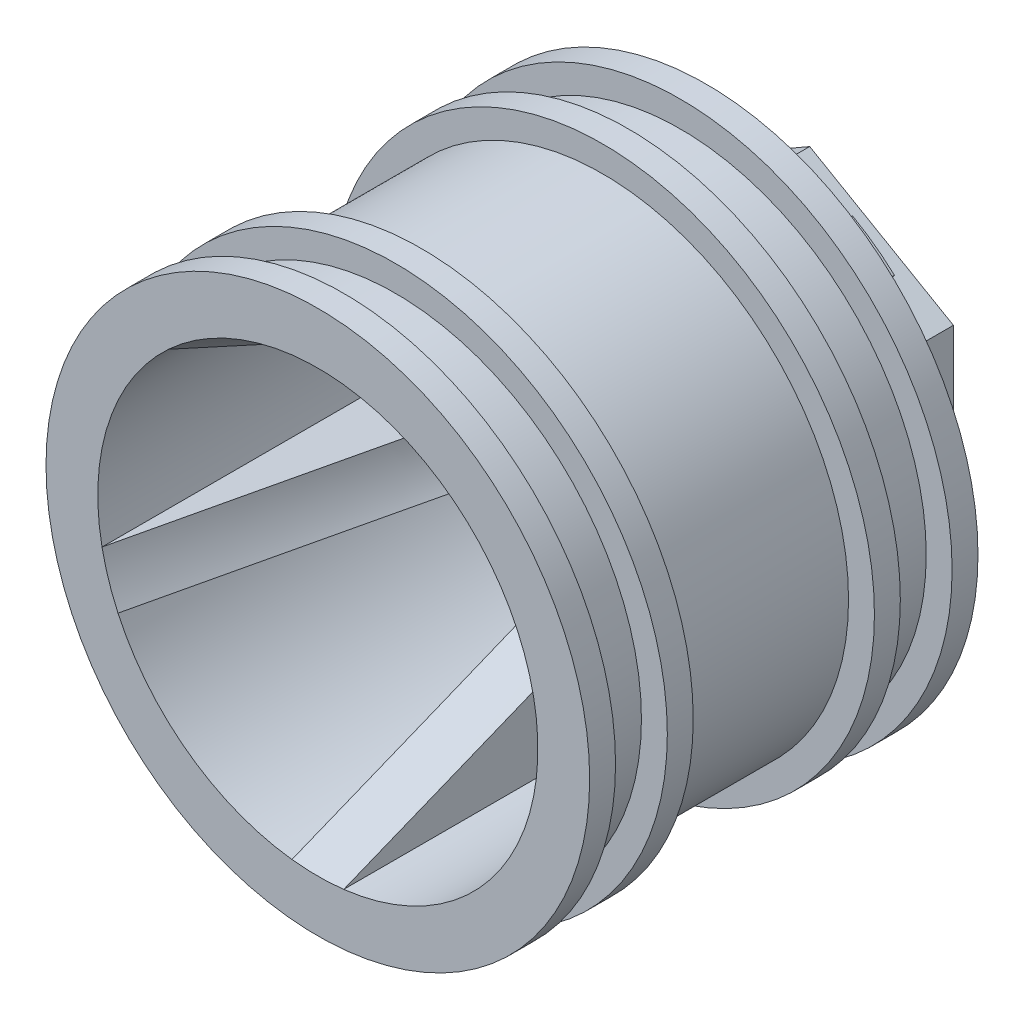
from build123d import *

# Parameters (mm, degrees)
SKETCH_1_R           = 19
SKETCH_1_R_2         = 17
EXTRUDE_1_DEPTH      = 30
SKETCH_16_R          = 17
EXTRUDE_9_DEPTH      = 3
SKETCH_4_R           = 9
EXTRUDE_2_DEPTH      = 10
CUT_EXTRUDE_8_DEPTH  = 10
EXTRUDE_10_DEPTH     = 30
SKETCH_6_R           = 2.25
CUT_EXTRUDE_9_DEPTH  = 70
SKETCH_9_R           = 21
SKETCH_9_R_2         = 19
EXTRUDE_4_DEPTH      = 2
SKETCH_10_R          = 21
SKETCH_10_R_2        = 19
EXTRUDE_5_DEPTH      = 2
EXTRUDE_START        = -2
SKETCH_11_R          = 21
SKETCH_11_R_2        = 19
EXTRUDE_6_DEPTH      = 2
EXTRUDE_START_2      = 2
SKETCH_12_R          = 21
SKETCH_12_R_2        = 19
EXTRUDE_7_DEPTH      = 2
SKETCH_13_W          = 6
SKETCH_13_H          = 6
CUT_EXTRUDE_5_DEPTH  = 2
SKETCH_14_R          = 2.15
EXTRUDE_11_DEPTH     = 5
SKETCH_22_R          = 6.15
CUT_EXTRUDE_10_DEPTH = 4
SKETCH_25_R          = 4.5
CUT_EXTRUDE_11_DEPTH = 2


with BuildPart() as part:
    # 草图1 → 凸台-拉伸1 (new body)
    with BuildSketch(Plane.XY):
        Circle(SKETCH_1_R)
        Circle(SKETCH_1_R_2, mode=Mode.SUBTRACT)
    extrude(amount=EXTRUDE_1_DEPTH)



with BuildPart() as body_2:
    # 草图16 → 凸台-拉伸9 (new body)
    with BuildSketch(Plane(origin=(0, 0, 0), x_dir=(-1, 0, 0), z_dir=(0, 0, -1))):
        with Locations(Location((0, 0, 0), (0, 0, 180))):
            Circle(SKETCH_16_R)
    extrude(amount=EXTRUDE_9_DEPTH)

    # 草图7 → 切除-拉伸8 (cut)
    with BuildSketch(Plane(origin=(0, 0, -3), x_dir=(-1, 0, 0), z_dir=(0, 0, -1))):
        with BuildLine():
            Line((-8.304923146, 14.833349303), (-3.539760668, 8.274665819))
            ThreePointArc((-3.539760668, 8.274665819), (0, 9), (3.539760668, 8.274665819))
            Line((3.539760668, 8.274665819), (8.304923146, 14.833349303))
            ThreePointArc((8.304923146, 14.833349303), (0, 17), (-8.304923146, 14.833349303))
        make_face()
        with BuildLine():
            ThreePointArc((9, 0), (8.990875637, -0.405160803), (8.96352105, -0.809500088))
            Line((8.96352105, -0.809500088), (16.673715902, -3.314694257))
            ThreePointArc((16.673715902, -3.314694257), (16.91823233, -1.665357269), (17, 0))
            ThreePointArc((17, 0), (15.575571404, 6.811870187), (11.540991124, 12.482208294))
            Line((11.540991124, 12.482208294), (6.775828645, 5.92352481))
            ThreePointArc((6.775828645, 5.92352481), (8.425629288, 3.163664188), (9, 0))
        make_face()
        with BuildLine():
            ThreePointArc((7.727453072, -4.613726153), (5.290067271, -7.281152949), (2, -8.774964387))
            Line((2, -8.774964387), (2, -16.881943016))
            ThreePointArc((2, -16.881943016), (9.992349289, -13.753288904), (15.437647924, -7.118920323))
            Line((15.437647924, -7.118920323), (7.727453072, -4.613726153))
        make_face()
        with BuildLine():
            Line((-2, -16.881943016), (-2, -8.774964387))
            ThreePointArc((-2, -8.774964387), (-5.290067271, -7.281152949), (-7.727453072, -4.613726153))
            Line((-7.727453072, -4.613726153), (-15.437647924, -7.118920323))
            ThreePointArc((-15.437647924, -7.118920323), (-9.992349289, -13.753288904), (-2, -16.881943016))
        make_face()
        with BuildLine():
            Line((-16.673715902, -3.314694257), (-8.96352105, -0.809500088))
            ThreePointArc((-8.96352105, -0.809500088), (-8.559508647, 2.781152949), (-6.775828645, 5.92352481))
            Line((-6.775828645, 5.92352481), (-11.540991124, 12.482208294))
            ThreePointArc((-11.540991124, 12.482208294), (-16.167960777, 5.253288904), (-16.673715902, -3.314694257))
        make_face()
    extrude(amount=-CUT_EXTRUDE_8_DEPTH, mode=Mode.SUBTRACT)


with BuildPart() as body_3:
    # 草图4 → 凸台-拉伸2 (new body)
    with BuildSketch(Plane.XY):
        Circle(SKETCH_4_R)
    extrude(amount=EXTRUDE_2_DEPTH)


with BuildPart() as part_1:
    add(part.part)

    add(body_2.part)  # 凸台-拉伸10 merges body 2

    add(body_3.part)  # 凸台-拉伸10 merges body 3
    # 草图21 → 凸台-拉伸10 (add)
    with BuildSketch(Plane.XY):
        with BuildLine():
            ThreePointArc((-6.775828645, 5.92352481), (-5.290067271, 7.281152949), (-3.539760668, 8.274665819))
            Line((-3.539760668, 8.274665819), (-8.304923146, 14.833349303))
            ThreePointArc((-8.304923146, 14.833349303), (-9.992349289, 13.753288904), (-11.540991124, 12.482208294))
            Line((-11.540991124, 12.482208294), (-6.775828645, 5.92352481))
        make_face()
        with BuildLine():
            Line((8.304923146, 14.833349303), (3.539760668, 8.274665819))
            ThreePointArc((3.539760668, 8.274665819), (5.290067271, 7.281152949), (6.775828645, 5.92352481))
            Line((6.775828645, 5.92352481), (11.540991124, 12.482208294))
            ThreePointArc((11.540991124, 12.482208294), (9.992349289, 13.753288904), (8.304923146, 14.833349303))
        make_face()
        with BuildLine():
            Line((16.673715902, -3.314694257), (8.96352105, -0.809500088))
            ThreePointArc((8.96352105, -0.809500088), (8.559508647, -2.781152949), (7.727453072, -4.613726153))
            Line((7.727453072, -4.613726153), (15.437647924, -7.118920323))
            ThreePointArc((15.437647924, -7.118920323), (16.167960777, -5.253288904), (16.673715902, -3.314694257))
        make_face()
        with BuildLine():
            Line((2, -16.881943016), (2, -8.774964387))
            ThreePointArc((2, -8.774964387), (0, -9), (-2, -8.774964387))
            Line((-2, -8.774964387), (-2, -16.881943016))
            ThreePointArc((-2, -16.881943016), (0, -17), (2, -16.881943016))
        make_face()
        with BuildLine():
            ThreePointArc((-7.727453072, -4.613726153), (-8.559508647, -2.781152949), (-8.96352105, -0.809500088))
            Line((-8.96352105, -0.809500088), (-16.673715902, -3.314694257))
            ThreePointArc((-16.673715902, -3.314694257), (-16.167960777, -5.253288904), (-15.437647924, -7.118920323))
            Line((-15.437647924, -7.118920323), (-7.727453072, -4.613726153))
        make_face()
    extrude(amount=EXTRUDE_10_DEPTH)

    # 草图6 → 切除-拉伸9 (cut)
    with BuildSketch(Plane.XY.offset(-3)):
        Circle(SKETCH_6_R)
    extrude(amount=CUT_EXTRUDE_9_DEPTH, mode=Mode.SUBTRACT)

    # 草图9 → 凸台-拉伸4 (add)
    with BuildSketch(Plane.XY):
        Circle(SKETCH_9_R)
        Circle(SKETCH_9_R_2, mode=Mode.SUBTRACT)
    extrude(amount=EXTRUDE_4_DEPTH)

    # 草图10 → 凸台-拉伸5 (add)
    with BuildSketch(Plane.XY.offset(6)):
        Circle(SKETCH_10_R)
        Circle(SKETCH_10_R_2, mode=Mode.SUBTRACT)
    extrude(amount=EXTRUDE_5_DEPTH)

    # 草图11 → 凸台-拉伸6 (add)
    with BuildSketch(Plane.XY.offset(30).offset(EXTRUDE_START)):
        Circle(SKETCH_11_R)
        Circle(SKETCH_11_R_2, mode=Mode.SUBTRACT)
    extrude(amount=EXTRUDE_6_DEPTH)

    # 草图12 → 凸台-拉伸7 (add)
    with BuildSketch(Plane(origin=(0, 0, 24), x_dir=(-1, 0, 0), z_dir=(0, 0, -1)).offset(EXTRUDE_START_2)):
        with Locations(Location((0, 0, 0), (0, 0, 180))):
            Circle(SKETCH_12_R)
        Circle(SKETCH_12_R_2, mode=Mode.SUBTRACT)
    extrude(amount=-EXTRUDE_7_DEPTH)

    # 草图13 → 切除-拉伸5 (cut)
    with BuildSketch(Plane.XY.offset(10)):
        Rectangle(SKETCH_13_W, SKETCH_13_H)
    extrude(amount=-CUT_EXTRUDE_5_DEPTH, mode=Mode.SUBTRACT)

    # 草图14 → 凸台-拉伸11 (add)
    with BuildSketch(Plane(origin=(0, 0, -3), x_dir=(-1, 0, 0), z_dir=(0, 0, -1))):
        Polygon((-11.1, -6.408587988), (0, -12.817175976), (11.1, -6.408587988), (11.1, 6.408587988), (0, 12.817175976), (-11.1, 6.408587988), align=None)
        Circle(SKETCH_14_R, mode=Mode.SUBTRACT)
    extrude(amount=EXTRUDE_11_DEPTH)

    # 草图22 → 切除-拉伸10 (cut)
    with BuildSketch(Plane(origin=(0, 0, -8), x_dir=(-1, 0, 0), z_dir=(0, 0, -1))):
        Circle(SKETCH_22_R)
    extrude(amount=-CUT_EXTRUDE_10_DEPTH, mode=Mode.SUBTRACT)

    # 草图25 → 切除-拉伸11 (cut)
    with BuildSketch(Plane(origin=(0, 0, -4), x_dir=(-1, 0, 0), z_dir=(0, 0, -1))):
        Circle(SKETCH_25_R)
    extrude(amount=-CUT_EXTRUDE_11_DEPTH, mode=Mode.SUBTRACT)

    # 草图28 → 切除-旋转1 (revolve, cut)
    with BuildSketch(Plane(origin=(0, 0, 0), x_dir=(0.9510565162951539, -0.3090169943749465, 0), z_dir=(-0.3090169943749465, -0.9510565162951539, 0)), mode=Mode.PRIVATE) as cut_revolve_1_sk:
        Polygon((17, 30), (9, 10), (9, 30), align=None)
    revolve(cut_revolve_1_sk.sketch.rotate(Axis((0, 0, 0), (0, 0, 1)), 198), axis=Axis((0, 0, 0), (0, 0, 1)), mode=Mode.SUBTRACT)


solid = part_1.part
